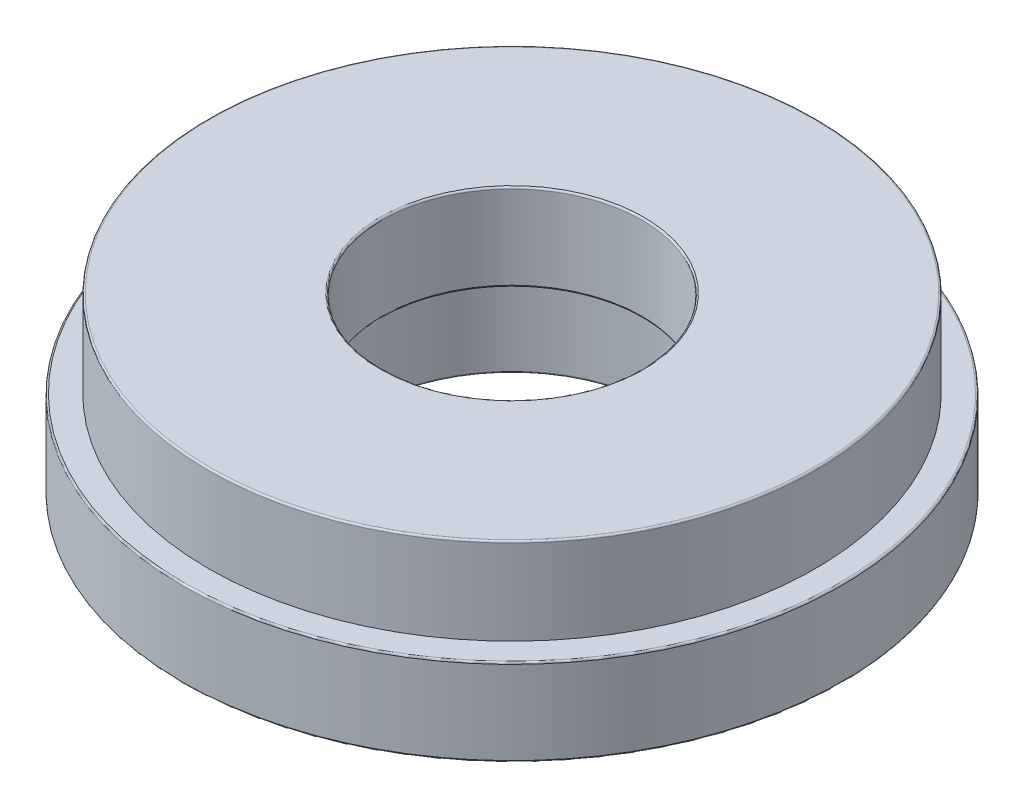
from build123d import *

# Parameters (mm, degrees)
SKETCH_1_R          = 19
EXTRUDE_1_DEPTH     = 5
SKETCH_1_3_R        = 3.05
CUT_EXTRUDE_1_DEPTH = 4
SKETCH_5_R          = 17.5
SKETCH_5_R_2        = 7.5
EXTRUDE_3_DEPTH     = 5
SKETCH_8_R          = 8.5
CUT_EXTRUDE_4_DEPTH = 5
FILLET_1_R          = 0.1


with BuildPart() as part:
    # 草图1 → 凸台-拉伸1 (new body)
    with BuildSketch(Plane(origin=(0, 0, 0), x_dir=(1, 0, 0), z_dir=(0, 1, 0))):
        with Locations(Location((0, 0, 0), (0, 0, 270))):
            Circle(SKETCH_1_R)
    extrude(amount=EXTRUDE_1_DEPTH)

    # 草图1<3> → 切除-拉伸1 (cut)
    with BuildSketch(Plane(origin=(0, 0, 0), x_dir=(1, 0, 0), z_dir=(0, 1, 0))):
        with Locations(Location((-12.990381057, 7.5, 0), (0, 0, 270))):
            Circle(SKETCH_1_3_R)
        with Locations(Location((-12.990381057, -7.5, 0), (0, 0, 270))):
            Circle(SKETCH_1_3_R)
        with Locations(Location((0, -15, 0), (0, 0, 270))):
            Circle(SKETCH_1_3_R)
        with Locations(Location((12.990381057, -7.5, 0), (0, 0, 270))):
            Circle(SKETCH_1_3_R)
        with Locations(Location((12.990381057, 7.5, 0), (0, 0, 270))):
            Circle(SKETCH_1_3_R)
        with Locations(Location((0, 15, 0), (0, 0, 270))):
            Circle(SKETCH_1_3_R)
    extrude(amount=CUT_EXTRUDE_1_DEPTH, mode=Mode.SUBTRACT)

    # 草图5 → 凸台-拉伸3 (add)
    with BuildSketch(Plane(origin=(0, 5, 0), x_dir=(1, 0, 0), z_dir=(0, 1, 0))):
        with Locations(Location((0, 0, 0), (0, 0, 270))):
            Circle(SKETCH_5_R)
        with Locations(Location((0, 0, 0), (0, 0, 270))):
            Circle(SKETCH_5_R_2, mode=Mode.SUBTRACT)
    extrude(amount=EXTRUDE_3_DEPTH)

    # 草图8 → 切除-拉伸4 (cut)
    with BuildSketch(Plane.XZ):
        with Locations(Location((0, 0, 0), (0, 0, 270))):
            Circle(SKETCH_8_R)
    extrude(amount=-CUT_EXTRUDE_4_DEPTH, mode=Mode.SUBTRACT)

    # 圆角1
    fillet_1_edges = [part.edges().sort_by_distance(p)[0] for p in [
        (0, 0, -18.05),
        (12.990381057, 0, -10.55),
        (12.990381057, 0, 4.45),
        (0, 0, 11.95),
        (-12.990381057, 0, 4.45),
        (-12.990381057, 0, -10.55),
        (0, 0, -19),
        (0, 10, -17.5),
        (0, 10, -7.5),
        (0, 5, -7.5),
        (0, 0, 8.5),
        (0, 5, -19),
    ]]
    fillet(fillet_1_edges, radius=FILLET_1_R)


solid = part.part
